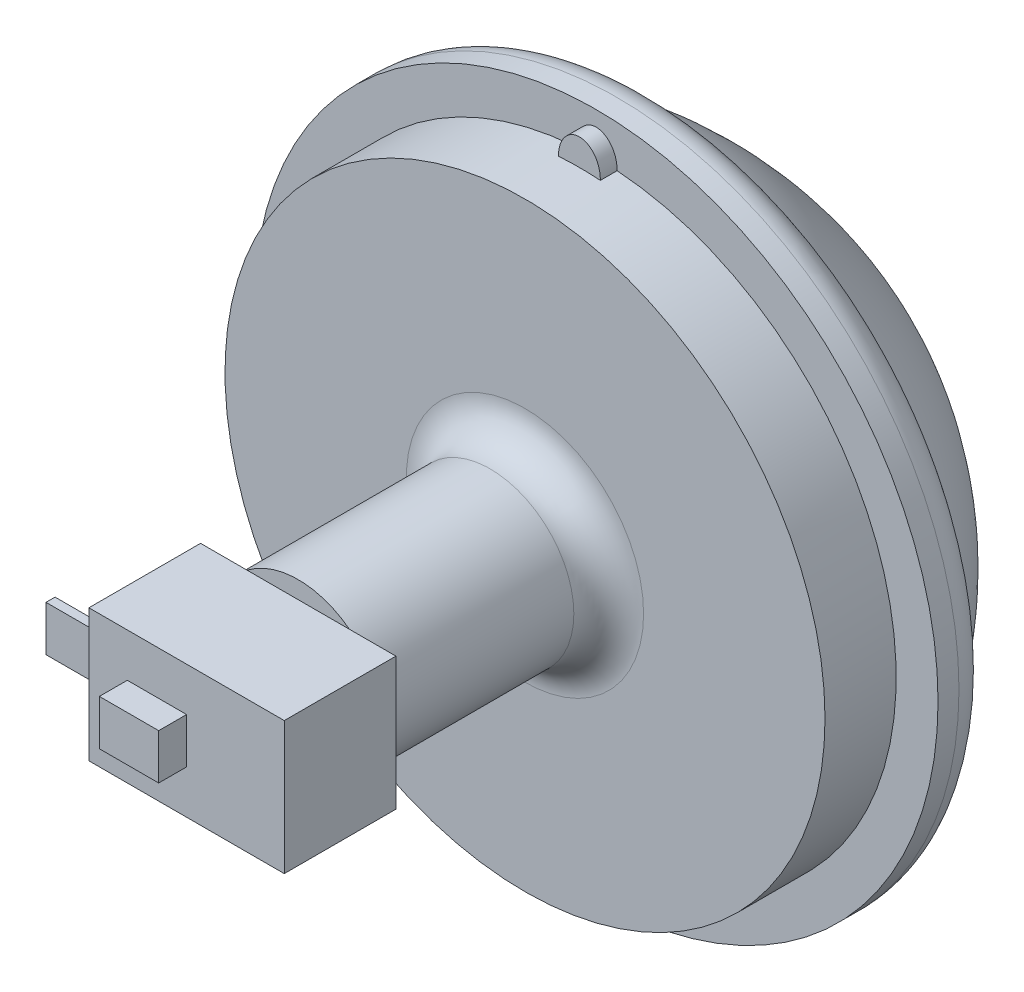
from build123d import *

# Parameters (mm, degrees)
SKETCH1_R           = 49
BOSS_EXTRUDE1_DEPTH = 8
FILLET1_R           = 5
SKETCH2_R           = 43
BOSS_EXTRUDE2_DEPTH = 10.2
SKETCH3_R           = 12
BOSS_EXTRUDE3_DEPTH = 32.5
FILLET2_R           = 5
SKETCH4_W           = 28
SKETCH4_H           = 19
BOSS_EXTRUDE4_DEPTH = 16
SKETCH5_W           = 8.5
SKETCH5_H           = 6.5
BOSS_EXTRUDE5_DEPTH = 4
SKETCH6_W           = 1.3
SKETCH6_H           = 6.5
BOSS_EXTRUDE6_DEPTH = 10
SKETCH7_RX          = 3.8
SKETCH7_RY          = 3
BOSS_EXTRUDE7_DEPTH = 2.4


with BuildPart() as part:
    # Sketch1 → Boss-Extrude1 (new body)
    with BuildSketch(Plane.XY):
        Circle(SKETCH1_R)
    extrude(amount=-BOSS_EXTRUDE1_DEPTH)

    # Fillet1
    fillet1_edges = [part.edges().sort_by_distance(p)[0] for p in [
        (-49, 0, -8),
    ]]
    fillet(fillet1_edges, radius=FILLET1_R)

    # Sketch2 → Boss-Extrude2 (add)
    with BuildSketch(Plane.XY):
        Circle(SKETCH2_R)
    extrude(amount=BOSS_EXTRUDE2_DEPTH)

    # Sketch3 → Boss-Extrude3 (add)
    with BuildSketch(Plane.XY.offset(10.2)):
        Circle(SKETCH3_R)
    extrude(amount=BOSS_EXTRUDE3_DEPTH)

    # Fillet2
    fillet2_edges = [part.edges().sort_by_distance(p)[0] for p in [
        (-12, 0, 10.2),
    ]]
    fillet(fillet2_edges, radius=FILLET2_R)

    # Sketch4 → Boss-Extrude4 (add)
    with BuildSketch(Plane.XY.offset(42.7)):
        Rectangle(SKETCH4_W, SKETCH4_H)
    extrude(amount=BOSS_EXTRUDE4_DEPTH)

    # Sketch5 → Boss-Extrude5 (add)
    with BuildSketch(Plane.XY.offset(58.7)):
        with Locations((-4.25, 0)):
            Rectangle(SKETCH5_W, SKETCH5_H)
    extrude(amount=BOSS_EXTRUDE5_DEPTH)

    # Sketch6 → Boss-Extrude6 (add)
    with BuildSketch(Plane.ZY.offset(14)):
        with Locations((54.2, 0)):
            Rectangle(SKETCH6_W, SKETCH6_H)
    extrude(amount=BOSS_EXTRUDE6_DEPTH)

    # Sketch7 → Boss-Extrude7 (add)
    with BuildSketch(Plane.XY):
        with Locations(Location((0, 43), (0, 0, -90))):
            Ellipse(SKETCH7_RX, SKETCH7_RY)
        with Locations(Location((0, -43), (0, 0, 90))):
            Ellipse(SKETCH7_RX, SKETCH7_RY)
    extrude(amount=BOSS_EXTRUDE7_DEPTH)

    # Sketch9 → Revolve4 (revolve)
    with BuildSketch(Plane(origin=(0, 0, 0), x_dir=(0, 0, -1), z_dir=(1, 0, 0)), mode=Mode.PRIVATE) as revolve4_sk:
        with BuildLine():
            Line((8, 0), (8, -44))
            ThreePointArc((8, -44), (27.170280261, -25.47949016), (35, 0))
            Line((35, 0), (8, 0))
        make_face()
    revolve(revolve4_sk.sketch.rotate(Axis((0, 0, -8), (0, 0, -1)), 3.999108691), axis=Axis((0, 0, -8), (0, 0, -1)))


solid = part.part
